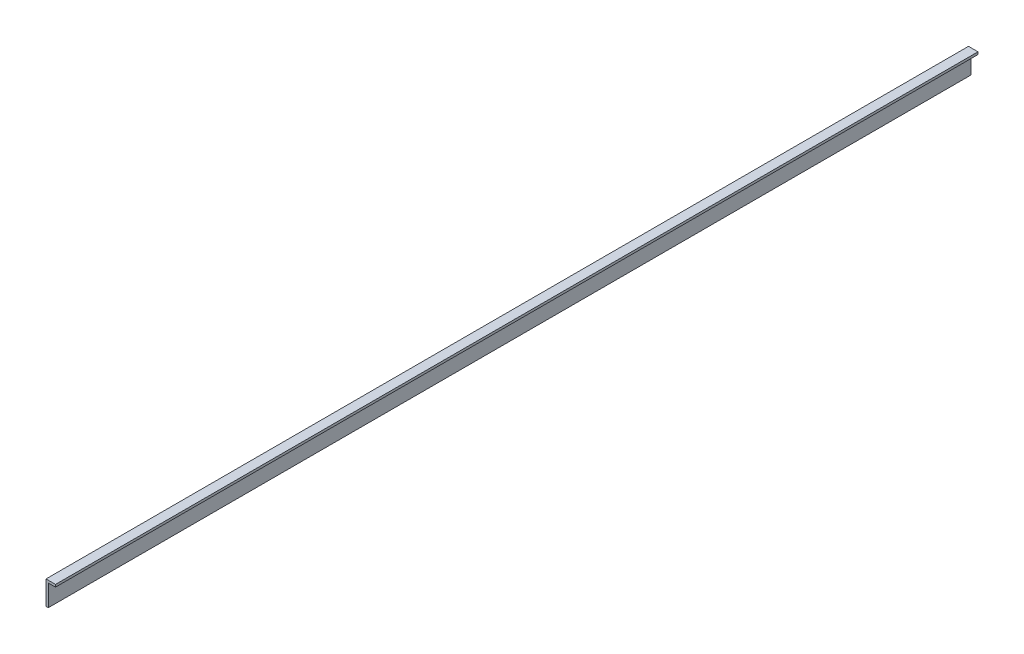
from build123d import *

# Parameters (mm, degrees)
LRAF_SOL_20X8X2_1_START = -20
LRAF_SOL_20X8X2_1_DEPTH = 777.5


with BuildPart() as part:
    # Sketch1 → LRAF_sol_20x8x2_1 (new body)
    with BuildSketch(Plane.XY.offset(LRAF_SOL_20X8X2_1_START)):
        Polygon((-54, 0), (-56, 0), (-56, 20), (-48, 20), (-48, 18), (-54, 18), align=None)
    extrude(amount=-LRAF_SOL_20X8X2_1_DEPTH)


solid = part.part
